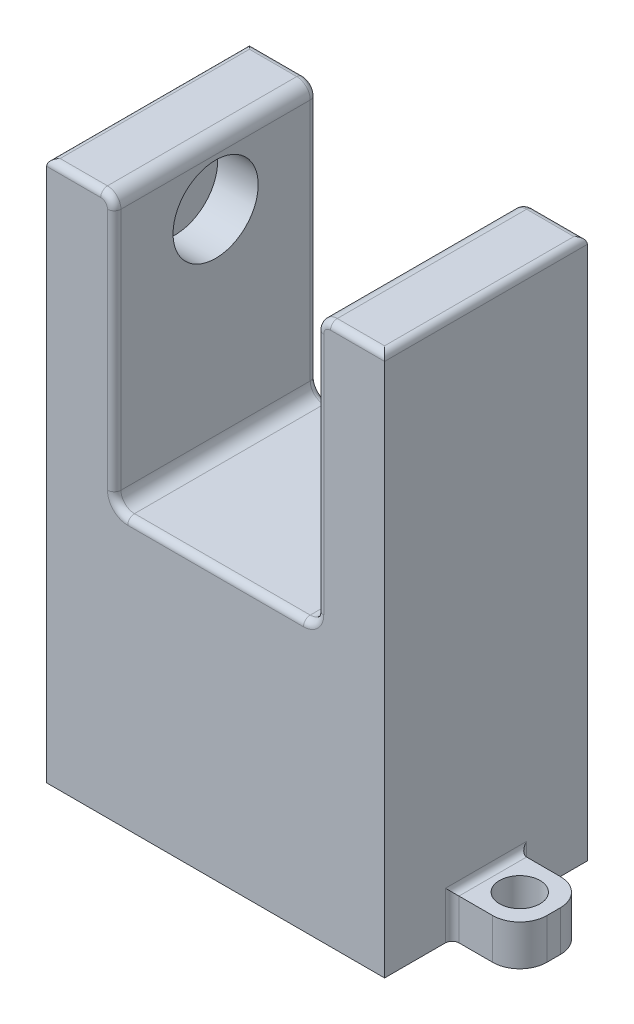
from build123d import *

# Parameters (mm, degrees)
CROQUIS2_W                 = 25
CROQUIS2_H                 = 15
SALIENTE_EXTRUIR1_DEPTH    = 40
CROQUIS3_W                 = 15
CROQUIS3_H                 = 15
CORTAR_EXTRUIR1_DEPTH      = 20
REDONDEO1_R                = 1
REDONDEO2_R                = 1
CORTAR_EXTRUIR2_DEPTH      = 18
CORTAR_EXTRUIR2_DEPTH_BACK = 3
CROQUIS4_R                 = 3.15
CROQUIS6_W                 = 5
CROQUIS6_H                 = 3
SALIENTE_EXTRUIR2_DEPTH    = 5
REDONDEO3_R                = 2
CROQUIS8_R                 = 1.5
CORTAR_EXTRUIR3_DEPTH      = 15
CROQUIS9_W                 = 5
CROQUIS9_H                 = 3
SALIENTE_EXTRUIR3_DEPTH    = 5
CORTAR_EXTRUIR4_REACH      = 43.611
CROQUIS10_R                = 1.5
REDONDEO4_R                = 2
REDONDEO5_R                = 0.5
REDONDEO6_R                = 0.5


with BuildPart() as part:
    # Croquis2 → Saliente-Extruir1 (new body)
    with BuildSketch(Plane(origin=(0, 0, 0), x_dir=(1, 0, 0), z_dir=(0, 1, 0))):
        Rectangle(CROQUIS2_W, CROQUIS2_H)
    extrude(amount=SALIENTE_EXTRUIR1_DEPTH)

    # Croquis3 → Cortar-Extruir1 (cut)
    with BuildSketch(Plane(origin=(0, 40, 0), x_dir=(1, 0, 0), z_dir=(0, 1, 0))):
        Rectangle(CROQUIS3_W, CROQUIS3_H)
    extrude(amount=-CORTAR_EXTRUIR1_DEPTH, mode=Mode.SUBTRACT)

    # Redondeo1
    redondeo1_edges = [part.edges().sort_by_distance(p)[0] for p in [
        (7.5, 20, 0),
        (-7.5, 20, 0),
    ]]
    fillet(redondeo1_edges, radius=REDONDEO1_R)

    # Redondeo2
    redondeo2_edges = [part.edges().sort_by_distance(p)[0] for p in [
        (7.5, 40, 0),
        (-7.5, 40, 0),
    ]]
    fillet(redondeo2_edges, radius=REDONDEO2_R)

    # Croquis4 → Cortar-Extruir2 (cut, two sides: drawn at the far end of the back side and taken through both)
    with BuildSketch(Plane(origin=(-7.5, 0, 0), x_dir=(0, 0, -1), z_dir=(1, 0, 0)).offset(-CORTAR_EXTRUIR2_DEPTH_BACK)):
        with Locations(Location((0, 35.5, 0), (0, 0, 180))):
            Circle(CROQUIS4_R)
    extrude(amount=CORTAR_EXTRUIR2_DEPTH + CORTAR_EXTRUIR2_DEPTH_BACK, mode=Mode.SUBTRACT)

    # Croquis6 → Saliente-Extruir2 (add)
    with BuildSketch(Plane(origin=(12.5, 0, 0), x_dir=(0, 0, -1), z_dir=(1, 0, 0))):
        with Locations((0, 1.5)):
            Rectangle(CROQUIS6_W, CROQUIS6_H)
    extrude(amount=SALIENTE_EXTRUIR2_DEPTH)

    # Redondeo3
    redondeo3_edges = [part.edges().sort_by_distance(p)[0] for p in [
        (17.5, 1.5, -2.5),
        (17.5, 1.5, 2.5),
    ]]
    fillet(redondeo3_edges, radius=REDONDEO3_R)

    # Croquis8 → Cortar-Extruir3 (cut)
    with BuildSketch(Plane(origin=(0, 3, 0), x_dir=(1, 0, 0), z_dir=(0, 1, 0))):
        with Locations(Location((15, 0, 0), (0, 0, 270))):
            Circle(CROQUIS8_R)
    extrude(amount=-CORTAR_EXTRUIR3_DEPTH, mode=Mode.SUBTRACT)

    # Croquis9 → Saliente-Extruir3 (add)
    with BuildSketch(Plane.ZY.offset(12.5)):
        with Locations((0, 1.5)):
            Rectangle(CROQUIS9_W, CROQUIS9_H)
    extrude(amount=SALIENTE_EXTRUIR3_DEPTH)

    # Croquis10 → Cortar-Extruir4 (cut, up to next)
    with BuildSketch(Plane(origin=(0, 3, 0), x_dir=(1, 0, 0), z_dir=(0, 1, 0)), mode=Mode.PRIVATE) as cortar_extruir4_sk1:
        with Locations(Location((-15, 0, 0), (0, 0, 270))):
            Circle(CROQUIS10_R)
    cortar_extruir4_tool1 = extrude(cortar_extruir4_sk1.sketch, amount=-CORTAR_EXTRUIR4_REACH, mode=Mode.PRIVATE) & part.part
    add(cortar_extruir4_tool1.solids().sort_by_distance((-15, 3, 0))[0], mode=Mode.SUBTRACT)

    # Redondeo4
    redondeo4_edges = [part.edges().sort_by_distance(p)[0] for p in [
        (-17.5, 1.5, 2.5),
        (-17.5, 1.5, -2.5),
    ]]
    fillet(redondeo4_edges, radius=REDONDEO4_R)

    # Redondeo5
    redondeo5_edges = [part.edges().sort_by_distance(p)[0] for p in [
        (12.5, 1.5, -2.5),
        (12.5, 3, 0),
        (12.5, 1.5, 2.5),
        (-12.5, 1.5, 2.5),
        (-12.5, 3, 0),
        (-12.5, 1.5, -2.5),
    ]]
    fillet(redondeo5_edges, radius=REDONDEO5_R)

    # Redondeo6
    redondeo6_edges = [part.edges().sort_by_distance(p)[0] for p in [
        (-12.5, 40, 0),
        (-10.5, 40, 7.5),
        (0, 20, -7.5),
        (0, 20, 7.5),
        (7.5, 30, -7.5),
        (7.5, 30, 7.5),
        (-7.5, 30, 7.5),
        (-7.5, 30, -7.5),
        (7.207106781, 20.292893219, -7.5),
        (7.207106781, 20.292893219, 7.5),
        (-7.207106781, 20.292893219, 7.5),
        (-7.207106781, 20.292893219, -7.5),
        (10.5, 40, 7.5),
        (7.792893219, 39.707106781, 7.5),
        (-7.792893219, 39.707106781, 7.5),
        (-10.5, 40, -7.5),
        (7.792893219, 39.707106781, -7.5),
        (-7.792893219, 39.707106781, -7.5),
        (12.5, 40, 0),
        (10.5, 40, -7.5),
    ]]
    fillet(redondeo6_edges, radius=REDONDEO6_R)


solid = part.part
